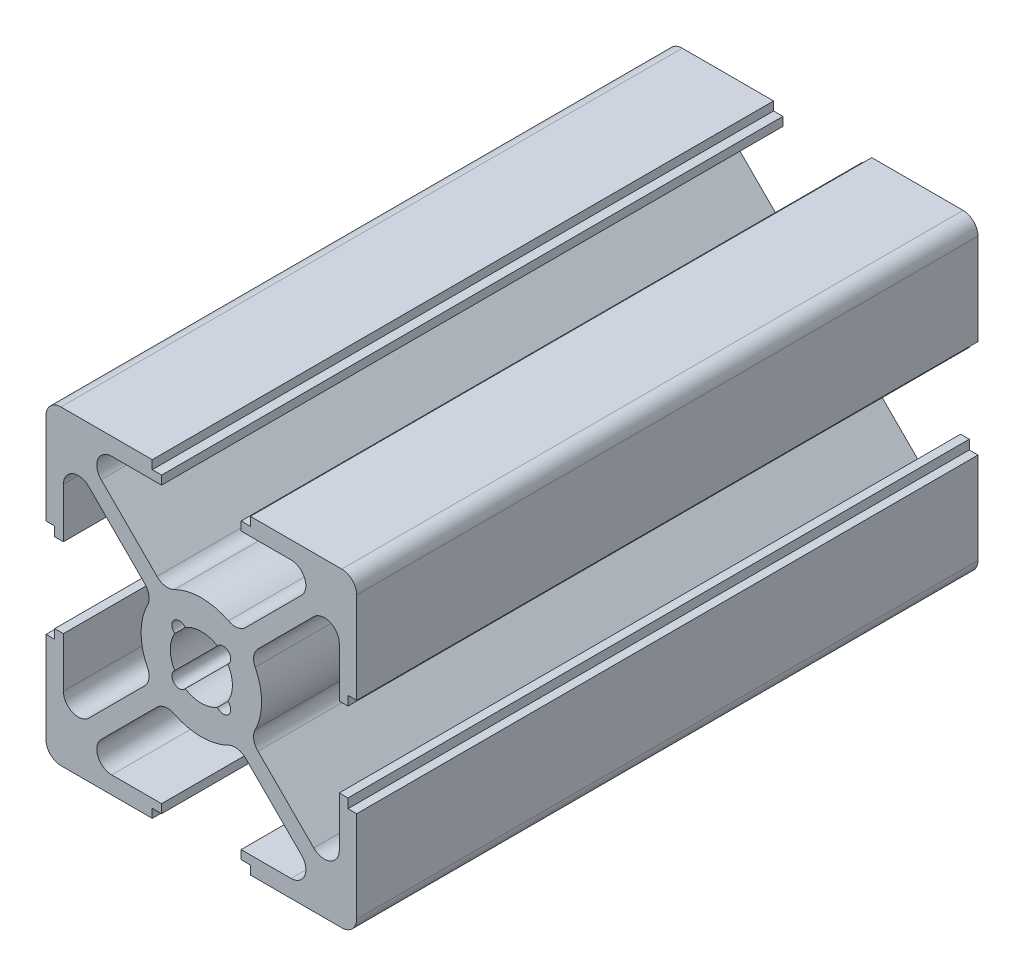
from build123d import *

# Parameters (mm, degrees)
Y_KSEKLIK_EKSTR_ZYON1_DEPTH = 50


with BuildPart() as part:
    # Çizim1 → Yükseklik-Ekstrüzyon1 (new body)
    with BuildSketch(Plane.XY):
        with BuildLine():
            Line((3.95, 12.5), (11.3, 12.5))
            ThreePointArc((11.3, 12.5), (12.148528137, 12.148528137), (12.5, 11.3))
            Line((12.5, 11.3), (12.5, 3.95))
            Line((12.5, 3.95), (11.8, 3.95))
            Line((11.8, 3.95), (11.8, 3.2))
            Line((11.8, 3.2), (11.1, 3.2))
            Line((11.1, 3.2), (11.1, 7.212994231))
            ThreePointArc((11.1, 7.212994231), (10.359220119, 8.321649671), (9.051471863, 8.061522369))
            Line((9.051471863, 8.061522369), (4.55653233, 3.566582836))
            ThreePointArc((4.55653233, 3.566582836), (4.220335715, 2.90891397), (4.332982358, 2.178936411))
            ThreePointArc((4.332982358, 2.178936411), (4.85, 0), (4.332982358, -2.178936411))
            ThreePointArc((4.332982358, -2.178936411), (4.220335715, -2.90891397), (4.55653233, -3.566582836))
            Line((4.55653233, -3.566582836), (9.051471863, -8.061522369))
            ThreePointArc((9.051471863, -8.061522369), (10.359220119, -8.321649671), (11.1, -7.212994231))
            Line((11.1, -7.212994231), (11.1, -3.2))
            Line((11.1, -3.2), (11.8, -3.2))
            Line((11.8, -3.2), (11.8, -3.95))
            Line((11.8, -3.95), (12.5, -3.95))
            Line((12.5, -3.95), (12.5, -11.3))
            ThreePointArc((12.5, -11.3), (12.148528137, -12.148528137), (11.3, -12.5))
            Line((11.3, -12.5), (3.95, -12.5))
            Line((3.95, -12.5), (3.95, -11.8))
            Line((3.95, -11.8), (3.2, -11.8))
            Line((3.2, -11.8), (3.2, -11.1))
            Line((3.2, -11.1), (7.212994231, -11.1))
            ThreePointArc((7.212994231, -11.1), (8.321649671, -10.359220119), (8.061522369, -9.051471863))
            Line((8.061522369, -9.051471863), (3.566582836, -4.55653233))
            ThreePointArc((3.566582836, -4.55653233), (2.90891397, -4.220335715), (2.178936411, -4.332982358))
            ThreePointArc((2.178936411, -4.332982358), (0, -4.85), (-2.178936411, -4.332982358))
            ThreePointArc((-2.178936411, -4.332982358), (-2.90891397, -4.220335715), (-3.566582836, -4.55653233))
            Line((-3.566582836, -4.55653233), (-8.061522369, -9.051471863))
            ThreePointArc((-8.061522369, -9.051471863), (-8.321649671, -10.359220119), (-7.212994231, -11.1))
            Line((-7.212994231, -11.1), (-3.2, -11.1))
            Line((-3.2, -11.1), (-3.2, -11.8))
            Line((-3.2, -11.8), (-3.95, -11.8))
            Line((-3.95, -11.8), (-3.95, -12.5))
            Line((-3.95, -12.5), (-11.3, -12.5))
            ThreePointArc((-11.3, -12.5), (-12.148528137, -12.148528137), (-12.5, -11.3))
            Line((-12.5, -11.3), (-12.5, -3.95))
            Line((-12.5, -3.95), (-11.8, -3.95))
            Line((-11.8, -3.95), (-11.8, -3.2))
            Line((-11.8, -3.2), (-11.1, -3.2))
            Line((-11.1, -3.2), (-11.1, -7.212994231))
            ThreePointArc((-11.1, -7.212994231), (-10.359220119, -8.321649671), (-9.051471863, -8.061522369))
            Line((-9.051471863, -8.061522369), (-4.55653233, -3.566582836))
            ThreePointArc((-4.55653233, -3.566582836), (-4.220335715, -2.90891397), (-4.332982358, -2.178936411))
            ThreePointArc((-4.332982358, -2.178936411), (-4.85, 0), (-4.332982358, 2.178936411))
            ThreePointArc((-4.332982358, 2.178936411), (-4.220335715, 2.90891397), (-4.55653233, 3.566582836))
            Line((-4.55653233, 3.566582836), (-9.051471863, 8.061522369))
            ThreePointArc((-9.051471863, 8.061522369), (-10.359220119, 8.321649671), (-11.1, 7.212994231))
            Line((-11.1, 7.212994231), (-11.1, 3.2))
            Line((-11.1, 3.2), (-11.8, 3.2))
            Line((-11.8, 3.2), (-11.8, 3.95))
            Line((-11.8, 3.95), (-12.5, 3.95))
            Line((-12.5, 3.95), (-12.5, 11.3))
            ThreePointArc((-12.5, 11.3), (-12.148528137, 12.148528137), (-11.3, 12.5))
            Line((-11.3, 12.5), (-3.95, 12.5))
            Line((-3.95, 12.5), (-3.95, 11.8))
            Line((-3.95, 11.8), (-3.2, 11.8))
            Line((-3.2, 11.8), (-3.2, 11.1))
            Line((-3.2, 11.1), (-7.212994231, 11.1))
            ThreePointArc((-7.212994231, 11.1), (-8.321649671, 10.359220119), (-8.061522369, 9.051471863))
            Line((-8.061522369, 9.051471863), (-3.566582836, 4.55653233))
            ThreePointArc((-3.566582836, 4.55653233), (-2.90891397, 4.220335715), (-2.178936411, 4.332982358))
            ThreePointArc((-2.178936411, 4.332982358), (0, 4.85), (2.178936411, 4.332982358))
            ThreePointArc((2.178936411, 4.332982358), (2.90891397, 4.220335715), (3.566582836, 4.55653233))
            Line((3.566582836, 4.55653233), (8.061522369, 9.051471863))
            ThreePointArc((8.061522369, 9.051471863), (8.321649671, 10.359220119), (7.212994231, 11.1))
            Line((7.212994231, 11.1), (3.2, 11.1))
            Line((3.2, 11.1), (3.2, 11.8))
            Line((3.2, 11.8), (3.95, 11.8))
            Line((3.95, 11.8), (3.95, 12.5))
        make_face()
        with BuildLine():
            ThreePointArc((1.295656974, 2.138053555), (0, 2.5), (-1.295656974, 2.138053555))
            ThreePointArc((-1.295656974, 2.138053555), (-2.192031022, 2.192031022), (-2.138053555, 1.295656974))
            ThreePointArc((-2.138053555, 1.295656974), (-2.5, 0), (-2.138053555, -1.295656974))
            ThreePointArc((-2.138053555, -1.295656974), (-2.192031022, -2.192031022), (-1.295656974, -2.138053555))
            ThreePointArc((-1.295656974, -2.138053555), (0, -2.5), (1.295656974, -2.138053555))
            ThreePointArc((1.295656974, -2.138053555), (2.192031022, -2.192031022), (2.138053555, -1.295656974))
            ThreePointArc((2.138053555, -1.295656974), (2.5, 0), (2.138053555, 1.295656974))
            ThreePointArc((2.138053555, 1.295656974), (2.192031022, 2.192031022), (1.295656974, 2.138053555))
        make_face(mode=Mode.SUBTRACT)
    extrude(amount=Y_KSEKLIK_EKSTR_ZYON1_DEPTH)


solid = part.part
